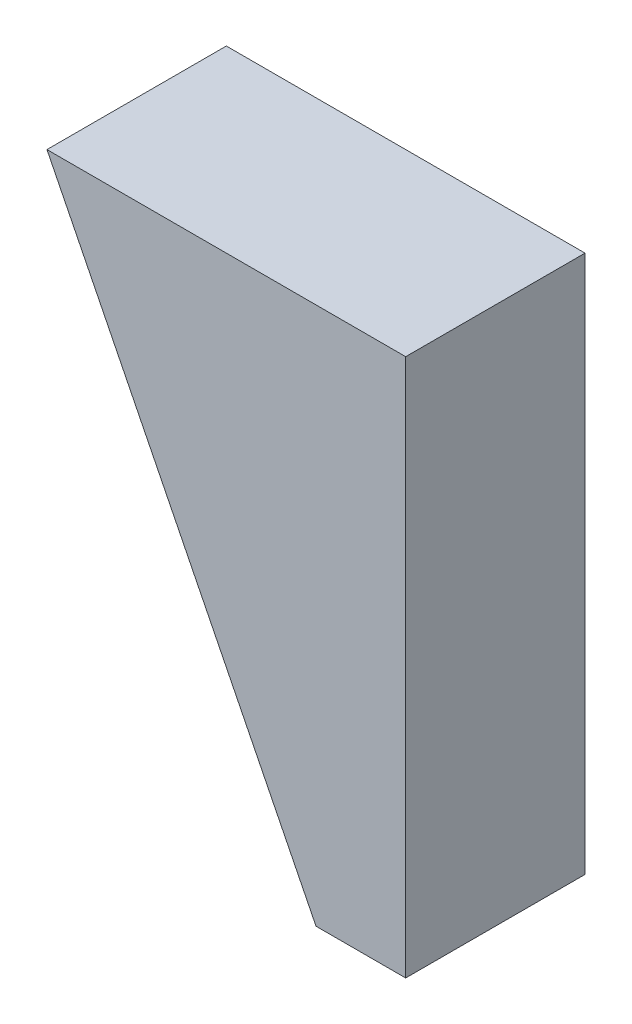
from build123d import *

# Parameters (mm, degrees)
BOSS_EXTRUDE1_DEPTH = 50.8


with BuildPart() as part:
    # Sketch1 → Boss-Extrude1 (new body)
    with BuildSketch(Plane.XY):
        Polygon((1341.25, 19.05), (1341.25, -133.35), (1315.85, -133.35), (1239.65, 19.05), align=None)
    extrude(amount=BOSS_EXTRUDE1_DEPTH)


solid = part.part
